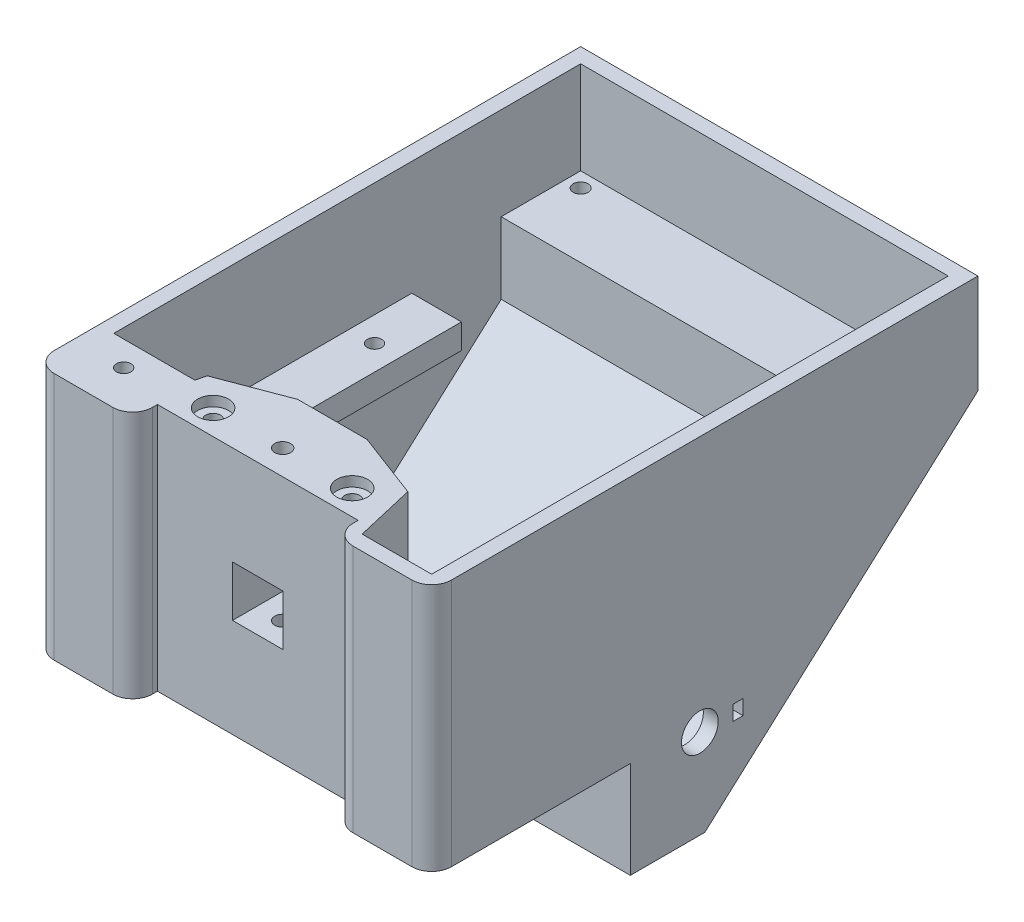
from build123d import *

# Parameters (mm, degrees)
BOSS_EXTRUDE1_DEPTH = 80
SHELL1_T            = -3
SKETCH3_W           = 46
SKETCH3_H           = 47
BOSS_EXTRUDE2_DEPTH = 17
SKETCH4_W           = 10.2
SKETCH4_H           = 10.2
CUT_EXTRUDE1_DEPTH  = 20
SKETCH6_W           = 15
SKETCH6_H           = 12.8
CUT_EXTRUDE2_DEPTH  = 3
SKETCH7_W           = 40.4
SKETCH7_H           = 50
CUT_EXTRUDE3_DEPTH  = 5
FILLET1_R           = 4
CUT_EXTRUDE7_DEPTH  = 47
SKETCH13_R          = 1.5
CUT_EXTRUDE8_DEPTH  = 25
SKETCH14_R          = 3.1
CUT_EXTRUDE9_DEPTH  = 2
SKETCH17_W          = 45
SKETCH17_H          = 5
BOSS_EXTRUDE5_DEPTH = 74
CUT_EXTRUDE10_REACH = 126.093
SKETCH18_W          = 54
SKETCH18_H          = 45
CUT_EXTRUDE11_REACH = 126.093
SKETCH19_R          = 1.45
BOSS_EXTRUDE6_DEPTH = 47
SKETCH22_R          = 1.45
CUT_EXTRUDE12_DEPTH = 135.415364765
SKETCH24_R          = 3.7
SKETCH24_W          = 2
SKETCH24_H          = 3
CUT_EXTRUDE13_DEPTH = 125.856940719
BOSS_EXTRUDE7_DEPTH = 74
SKETCH27_R          = 1.5
CUT_EXTRUDE14_DEPTH = 10
CUT_EXTRUDE15_START = -3
CUT_EXTRUDE15_DEPTH = 32
CUT_EXTRUDE16_DEPTH = 30
BOSS_EXTRUDE8_DEPTH = 20
SKETCH31_R          = 1.5
CUT_EXTRUDE17_DEPTH = 123.649786567
CUT_EXTRUDE18_DEPTH = 15
CUT_EXTRUDE19_REACH = 126.093
SKETCH33_W          = 10
SKETCH33_H          = 5
SKETCH34_R          = 1.6
CUT_EXTRUDE20_DEPTH = 135.415364765
CUT_EXTRUDE22_DEPTH = 14


with BuildPart() as part:
    # Sketch2 → Boss-Extrude1 (new body)
    with BuildSketch(Plane(origin=(0, 0, 0), x_dir=(0, 0, -1), z_dir=(1, 0, 0))):
        Polygon((-27.320490368, 20.998248687), (-27.320490368, -29.001751313), (12.679509632, -29.001751313), (12.679509632, -48.511383538), (27.679509632, -48.511383538), (82.679509632, 0.998248687), (82.679509632, 20.998248687), align=None)
    extrude(amount=BOSS_EXTRUDE1_DEPTH)

    # Shell1
    shell1_openings = [part.faces().sort_by_distance(p)[0] for p in [
        (40, 20.998248687, -27.679509632),
    ]]
    offset(amount=SHELL1_T, openings=shell1_openings, kind=Kind.INTERSECTION)

    # Sketch3 → Boss-Extrude2 (add)
    with BuildSketch(Plane(origin=(0, 0, 24.320490368), x_dir=(-1, 0, 0), z_dir=(0, 0, -1))):
        with Locations((-40, -2.501751313)):
            Rectangle(SKETCH3_W, SKETCH3_H)
    extrude(amount=BOSS_EXTRUDE2_DEPTH)

    # Sketch4 → Cut-Extrude1 (cut)
    with BuildSketch(Plane.XY.offset(27.320490368)):
        with Locations((40, -4.001751313)):
            Rectangle(SKETCH4_W, SKETCH4_H)
    extrude(amount=-CUT_EXTRUDE1_DEPTH, mode=Mode.SUBTRACT)

    # Sketch6 → Cut-Extrude2 (cut)
    with BuildSketch(Plane.XZ.offset(29.001751313)):
        with Locations((40, 0.920490368)):
            Rectangle(SKETCH6_W, SKETCH6_H)
    extrude(amount=-CUT_EXTRUDE2_DEPTH, mode=Mode.SUBTRACT)

    # Sketch7 → Cut-Extrude3 (cut)
    with BuildSketch(Plane.XY.offset(27.320490368)):
        with Locations((40, -4.001751313)):
            Rectangle(SKETCH7_W, SKETCH7_H)
    extrude(amount=-CUT_EXTRUDE3_DEPTH, mode=Mode.SUBTRACT)

    # Fillet1
    fillet1_edges = [part.edges().sort_by_distance(p)[0] for p in [
        (80, -4.001751313, 27.320490368),
        (19.8, -4.001751313, 27.320490368),
        (0, -4.001751313, 27.320490368),
        (60.2, -4.001751313, 27.320490368),
    ]]
    fillet(fillet1_edges, radius=FILLET1_R)

    # Sketch12 → Cut-Extrude7 (cut)
    with BuildSketch(Plane(origin=(0, 20.998248687, 0), x_dir=(1, 0, 0), z_dir=(0, 1, 0))):
        Polygon((33, -7.320490368), (19.8, -12.320490368), (17, -24.320490368), (17, -7.320490368), align=None)
        Polygon((47, -7.320490368), (63, -7.320490368), (63, -24.320490368), (60.2, -12.320490368), align=None)
    extrude(amount=-CUT_EXTRUDE7_DEPTH, mode=Mode.SUBTRACT)

    # Sketch13 → Cut-Extrude8 (cut)
    with BuildSketch(Plane(origin=(0, 20.998248687, 0), x_dir=(1, 0, 0), z_dir=(0, 1, 0))):
        with Locations(Location((26, -17.320490368, 0), (0, 0, 270))):
            Circle(SKETCH13_R)
        with Locations(Location((54, -17.320490368, 0), (0, 0, 270))):
            Circle(SKETCH13_R)
    extrude(amount=-CUT_EXTRUDE8_DEPTH, mode=Mode.SUBTRACT)

    # Sketch14 → Cut-Extrude9 (cut)
    with BuildSketch(Plane(origin=(0, 20.998248687, 0), x_dir=(1, 0, 0), z_dir=(0, 1, 0))):
        with Locations(Location((26, -17.320490368, 0), (0, 0, 270))):
            Circle(SKETCH14_R)
        with Locations(Location((54, -17.320490368, 0), (0, 0, 270))):
            Circle(SKETCH14_R)
    extrude(amount=-CUT_EXTRUDE9_DEPTH, mode=Mode.SUBTRACT)

    # Sketch17 → Boss-Extrude5 (add)
    with BuildSketch(Plane.ZY.offset(-77)):
        with Locations((-23.179509632, -4.501751313)):
            Rectangle(SKETCH17_W, SKETCH17_H)
    extrude(amount=BOSS_EXTRUDE5_DEPTH)

    # Sketch18 → Cut-Extrude10 (cut, up to next)
    with BuildSketch(Plane(origin=(0, -2.001751313, 0), x_dir=(1, 0, 0), z_dir=(0, 1, 0)), mode=Mode.PRIVATE) as cut_extrude10_sk1:
        with Locations((40, 23.179509632)):
            Rectangle(SKETCH18_W, SKETCH18_H)
    cut_extrude10_tool1 = extrude(cut_extrude10_sk1.sketch, amount=-CUT_EXTRUDE10_REACH, mode=Mode.PRIVATE) & part.part
    add(cut_extrude10_tool1.solids().sort_by_distance((40, -2.001751, -23.17951))[0], mode=Mode.SUBTRACT)

    # Sketch19 → Cut-Extrude11 (cut, up to next)
    with BuildSketch(Plane(origin=(0, -2.001751313, 0), x_dir=(1, 0, 0), z_dir=(0, 1, 0)), mode=Mode.PRIVATE) as cut_extrude11_sk1:
        with Locations(Location((72, 37.179509632, 0), (0, 0, 270))):
            Circle(SKETCH19_R)
    cut_extrude11_tool1 = extrude(cut_extrude11_sk1.sketch, amount=-CUT_EXTRUDE11_REACH, mode=Mode.PRIVATE) & part.part
    # Sketch19 → Cut-Extrude11 (cut, up to next)
    with BuildSketch(Plane(origin=(0, -2.001751313, 0), x_dir=(1, 0, 0), z_dir=(0, 1, 0)), mode=Mode.PRIVATE) as cut_extrude11_sk2:
        with Locations(Location((72, 6.179509632, 0), (0, 0, 270))):
            Circle(SKETCH19_R)
    cut_extrude11_tool2 = extrude(cut_extrude11_sk2.sketch, amount=-CUT_EXTRUDE11_REACH, mode=Mode.PRIVATE) & part.part
    # Sketch19 → Cut-Extrude11 (cut, up to next)
    with BuildSketch(Plane(origin=(0, -2.001751313, 0), x_dir=(1, 0, 0), z_dir=(0, 1, 0)), mode=Mode.PRIVATE) as cut_extrude11_sk3:
        with Locations(Location((8, 33.179509632, 0), (0, 0, 270))):
            Circle(SKETCH19_R)
    cut_extrude11_tool3 = extrude(cut_extrude11_sk3.sketch, amount=-CUT_EXTRUDE11_REACH, mode=Mode.PRIVATE) & part.part
    # Sketch19 → Cut-Extrude11 (cut, up to next)
    with BuildSketch(Plane(origin=(0, -2.001751313, 0), x_dir=(1, 0, 0), z_dir=(0, 1, 0)), mode=Mode.PRIVATE) as cut_extrude11_sk4:
        with Locations(Location((8, 6.179509632, 0), (0, 0, 270))):
            Circle(SKETCH19_R)
    cut_extrude11_tool4 = extrude(cut_extrude11_sk4.sketch, amount=-CUT_EXTRUDE11_REACH, mode=Mode.PRIVATE) & part.part
    add(cut_extrude11_tool1.solids().sort_by_distance((72, -2.001751, -37.17951))[0], mode=Mode.SUBTRACT)
    add(cut_extrude11_tool2.solids().sort_by_distance((72, -2.001751, -6.17951))[0], mode=Mode.SUBTRACT)
    add(cut_extrude11_tool3.solids().sort_by_distance((8, -2.001751, -33.17951))[0], mode=Mode.SUBTRACT)
    add(cut_extrude11_tool4.solids().sort_by_distance((8, -2.001751, -6.17951))[0], mode=Mode.SUBTRACT)

    # Sketch21 → Boss-Extrude6 (add)
    with BuildSketch(Plane(origin=(0, -26.001751313, 0), x_dir=(1, 0, 0), z_dir=(0, 1, 0))):
        Polygon((3, -24.320490368), (3, -14.320490368), (19.333333333, -14.320490368), (17, -24.320490368), align=None)
    extrude(amount=BOSS_EXTRUDE6_DEPTH)

    # Sketch22 → Cut-Extrude12 (cut, through all)
    with BuildSketch(Plane(origin=(0, 20.998248687, 0), x_dir=(1, 0, 0), z_dir=(0, 1, 0))):
        with Locations(Location((10, -19.320490368, 0), (0, 0, 270))):
            Circle(SKETCH22_R)
    extrude(amount=-CUT_EXTRUDE12_DEPTH, mode=Mode.SUBTRACT)

    # Sketch24 → Cut-Extrude13 (cut, through all)
    with BuildSketch(Plane(origin=(80, 0, 0), x_dir=(0, 0, -1), z_dir=(1, 0, 0))):
        with Locations((26.679509632, -30.511383538)):
            Circle(SKETCH24_R)
        with Locations((34.379509632, -30.511383538)):
            Rectangle(SKETCH24_W, SKETCH24_H)
    extrude(amount=-CUT_EXTRUDE13_DEPTH, mode=Mode.SUBTRACT)

    # Sketch26 → Boss-Extrude7 (add)
    with BuildSketch(Plane(origin=(3, 0, 0), x_dir=(0, 0, -1), z_dir=(1, 0, 0))):
        Polygon((79.679509632, 2.334161996), (63.679509632, 2.334161996), (63.679509632, -12.068640106), align=None)
    extrude(amount=BOSS_EXTRUDE7_DEPTH)

    # Sketch27 → Cut-Extrude14 (cut)
    with BuildSketch(Plane(origin=(0, 2.334161996, 0), x_dir=(1, 0, 0), z_dir=(0, 1, 0))):
        with Locations(Location((6, 76.679509632, 0), (0, 0, 270))):
            Circle(SKETCH27_R)
        with Locations(Location((74, 76.679509632, 0), (0, 0, 270))):
            Circle(SKETCH27_R)
    extrude(amount=-CUT_EXTRUDE14_DEPTH, mode=Mode.SUBTRACT)

    # Sketch28 → Cut-Extrude15 (cut)
    with BuildSketch(Plane(origin=(0, 2.334161996, 0), x_dir=(1, 0, 0), z_dir=(0, 1, 0)).offset(CUT_EXTRUDE15_START)):
        Polygon((74, 79.929509632), (71.185417438, 78.304509632), (71.185417438, 75.054509632), (74, 73.429509632), (76.814582562, 75.054509632), (76.814582562, 78.304509632), align=None)
        Polygon((6, 73.429509632), (8.814582562, 75.054509632), (8.814582562, 78.304509632), (6, 79.929509632), (3.185417438, 78.304509632), (3.185417438, 75.054509632), align=None)
    extrude(amount=-CUT_EXTRUDE15_DEPTH, mode=Mode.SUBTRACT)

    # Sketch29 → Cut-Extrude16 (cut)
    with BuildSketch(Plane.XZ.offset(29.001751313)):
        Polygon((7.185417438, 17.695490368), (10, 16.070490368), (12.814582562, 17.695490368), (12.814582562, 20.945490368), (10, 22.570490368), (7.185417438, 20.945490368), align=None)
    extrude(amount=-CUT_EXTRUDE16_DEPTH, mode=Mode.SUBTRACT)

    # Sketch30 → Boss-Extrude8 (add)
    with BuildSketch(Plane(origin=(0, -26.001751313, 0), x_dir=(1, 0, 0), z_dir=(0, 1, 0))):
        Polygon((77, -24.320490368), (63, -24.320490368), (60.2, -12.320490368), (77, -12.320490368), align=None)
    extrude(amount=BOSS_EXTRUDE8_DEPTH)

    # Sketch31 → Cut-Extrude17 (cut, through all)
    with BuildSketch(Plane(origin=(0, -6.001751313, 0), x_dir=(1, 0, 0), z_dir=(0, 1, 0))):
        with Locations(Location((72, -21.320490368, 0), (0, 0, 270))):
            Circle(SKETCH31_R)
    extrude(amount=-CUT_EXTRUDE17_DEPTH, mode=Mode.SUBTRACT)

    # Sketch32 → Cut-Extrude18 (cut)
    with BuildSketch(Plane.XZ.offset(29.001751313)):
        Polygon((72, 24.570490368), (69.185417438, 22.945490368), (69.185417438, 19.695490368), (72, 18.070490368), (74.814582562, 19.695490368), (74.814582562, 22.945490368), align=None)
    extrude(amount=-CUT_EXTRUDE18_DEPTH, mode=Mode.SUBTRACT)

    # Sketch33 → Cut-Extrude19 (cut, up to next)
    with BuildSketch(Plane(origin=(0, -2.001751313, 0), x_dir=(1, 0, 0), z_dir=(0, 1, 0)), mode=Mode.PRIVATE) as cut_extrude19_sk1:
        with Locations((72, 43.179509632)):
            Rectangle(SKETCH33_W, SKETCH33_H)
    cut_extrude19_tool1 = extrude(cut_extrude19_sk1.sketch, amount=-CUT_EXTRUDE19_REACH, mode=Mode.PRIVATE) & part.part
    add(cut_extrude19_tool1.solids().sort_by_distance((72, -2.001751, -43.17951))[0], mode=Mode.SUBTRACT)

    # Sketch34 → Cut-Extrude20 (cut, through all)
    with BuildSketch(Plane(origin=(0, 20.998248687, 0), x_dir=(1, 0, 0), z_dir=(0, 1, 0))):
        with Locations(Location((40, -17.320490368, 0), (0, 0, 270))):
            Circle(SKETCH34_R)
    extrude(amount=-CUT_EXTRUDE20_DEPTH, mode=Mode.SUBTRACT)

    # Sketch36 → Cut-Extrude22 (cut)
    with BuildSketch(Plane.XZ.offset(29.001751313)):
        Polygon((38.375, 20.13507293), (36.75, 17.320490368), (38.375, 14.505907805), (41.625, 14.505907805), (43.25, 17.320490368), (41.625, 20.13507293), align=None)
    extrude(amount=-CUT_EXTRUDE22_DEPTH, mode=Mode.SUBTRACT)


solid = part.part
